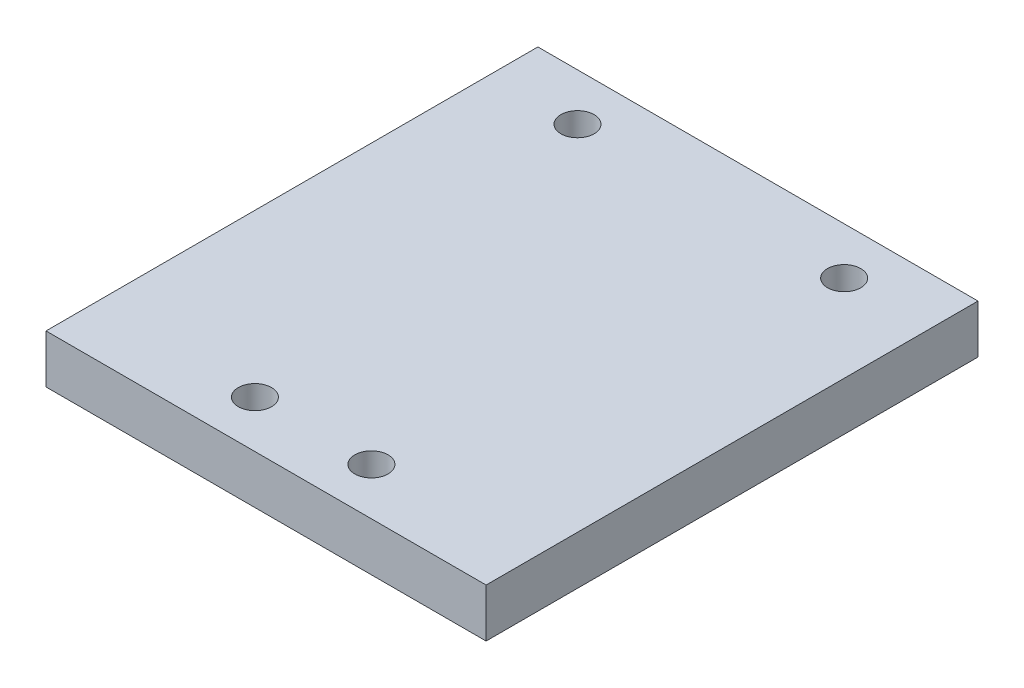
from build123d import *

# Parameters (mm, degrees)
SKETCH1_W             = 43.18
SKETCH1_H             = 48.26
BASE_DEPTH            = 4.7625
MOTORHOLES_AT_2_COUNT = 2
MOTORHOLES_AT_2_PITCH = 11.43
MOTORHOLES_AT_3_COUNT = 2
MOTORHOLES_AT_3_PITCH = 43.30603911
MOTORHOLES_AT_4_COUNT = 2
MOTORHOLES_AT_4_PITCH = 39.703669394


with BuildPart() as part:
    # Sketch1 → Base (new body)
    with BuildSketch(Plane(origin=(0, 0, 0), x_dir=(1, 0, 0), z_dir=(0, 1, 0))):
        Rectangle(SKETCH1_W, SKETCH1_H)
    extrude(amount=BASE_DEPTH)

    # Sketch2 → MotorHoles (revolve, cut)
    with BuildSketch(Plane(origin=(5.715, 0, 19.5072), x_dir=(0, 0, -1), z_dir=(1, 0, 0))):
        Polygon((0, 0), (0, 4.7625), (1.63195, 4.7625), (1.63195, 1.7272), (3.37312, 1.7272), (3.37312, 0.635), (4.00812, 0), align=None)
    motorholes = revolve(axis=Axis((5.715, -6.35, 19.5072), (0, 1, 0)), mode=Mode.SUBTRACT)

    # MotorHoles at 2: MotorHoles ×2
    with Locations(*[(-i * MOTORHOLES_AT_2_PITCH, 0, 0) for i in range(1, MOTORHOLES_AT_2_COUNT)]):
        add(motorholes, mode=Mode.SUBTRACT)

    # MotorHoles at 3: MotorHoles ×2
    with Locations(*[Vector(-0.43402722545097383, 0, -0.9008997544495889) * (i * MOTORHOLES_AT_3_PITCH) for i in range(1, MOTORHOLES_AT_3_COUNT)]):
        add(motorholes, mode=Mode.SUBTRACT)

    # MotorHoles at 4: MotorHoles ×2
    with Locations(*[Vector(0.1855244140503859, 0, -0.9826396551082502) * (i * MOTORHOLES_AT_4_PITCH) for i in range(1, MOTORHOLES_AT_4_COUNT)]):
        add(motorholes, mode=Mode.SUBTRACT)


solid = part.part
